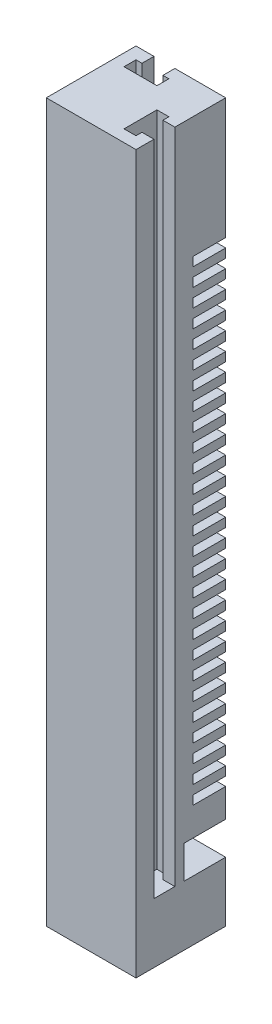
from build123d import *

# Parameters (mm, degrees)
SKETCH1_W           = 15
SKETCH1_H           = 15
BOSS_EXTRUDE1_DEPTH = 120
CUT_EXTRUDE1_DEPTH  = 110
CUT_EXTRUDE2_START  = -20.25
CUT_EXTRUDE2_DEPTH  = 1.5
LPATTERN1_COUNT     = 27
LPATTERN1_PITCH     = 3
CUT_EXTRUDE3_START  = -10
SKETCH6_W           = 7
SKETCH6_H           = 7
CUT_EXTRUDE3_DEPTH  = 5.5


with BuildPart() as part:
    # Sketch1 → Boss-Extrude1 (new body)
    with BuildSketch(Plane(origin=(0, 0, 0), x_dir=(1, 0, 0), z_dir=(0, 1, 0))):
        with Locations((7.5, 7.5)):
            Rectangle(SKETCH1_W, SKETCH1_H)
    extrude(amount=BOSS_EXTRUDE1_DEPTH)

    # Sketch3 → Cut-Extrude1 (cut)
    with BuildSketch(Plane(origin=(0, 120, 0), x_dir=(1, 0, 0), z_dir=(0, 1, 0))):
        Polygon((15, 3), (13, 3), (13, 2), (11, 2), (11, 7.5), (13, 7.5), (13, 6.5), (15, 6.5), align=None)
        Polygon((3, 13), (2, 13), (2, 11), (7.5, 11), (7.5, 13), (6.5, 13), (6.5, 15), (3, 15), align=None)
    extrude(amount=-CUT_EXTRUDE1_DEPTH, mode=Mode.SUBTRACT)

    # Sketch5 → Cut-Extrude2 (cut)
    with BuildSketch(Plane(origin=(0, 120, 0), x_dir=(1, 0, 0), z_dir=(0, 1, 0)).offset(CUT_EXTRUDE2_START)):
        Polygon((15, 15), (15, 9.5), (9.5, 15), align=None)
    cut_extrude2 = extrude(amount=-CUT_EXTRUDE2_DEPTH, mode=Mode.SUBTRACT)

    # LPattern1: Cut-Extrude2 ×27
    with Locations(*[(0, -i * LPATTERN1_PITCH, 0) for i in range(1, LPATTERN1_COUNT)]):
        add(cut_extrude2, mode=Mode.SUBTRACT)

    # Sketch6 → Cut-Extrude3 (cut)
    with BuildSketch(Plane.XZ.offset(CUT_EXTRUDE3_START)):
        with Locations((11.5, -11.5)):
            Rectangle(SKETCH6_W, SKETCH6_H)
    extrude(amount=-CUT_EXTRUDE3_DEPTH, mode=Mode.SUBTRACT)


solid = part.part
